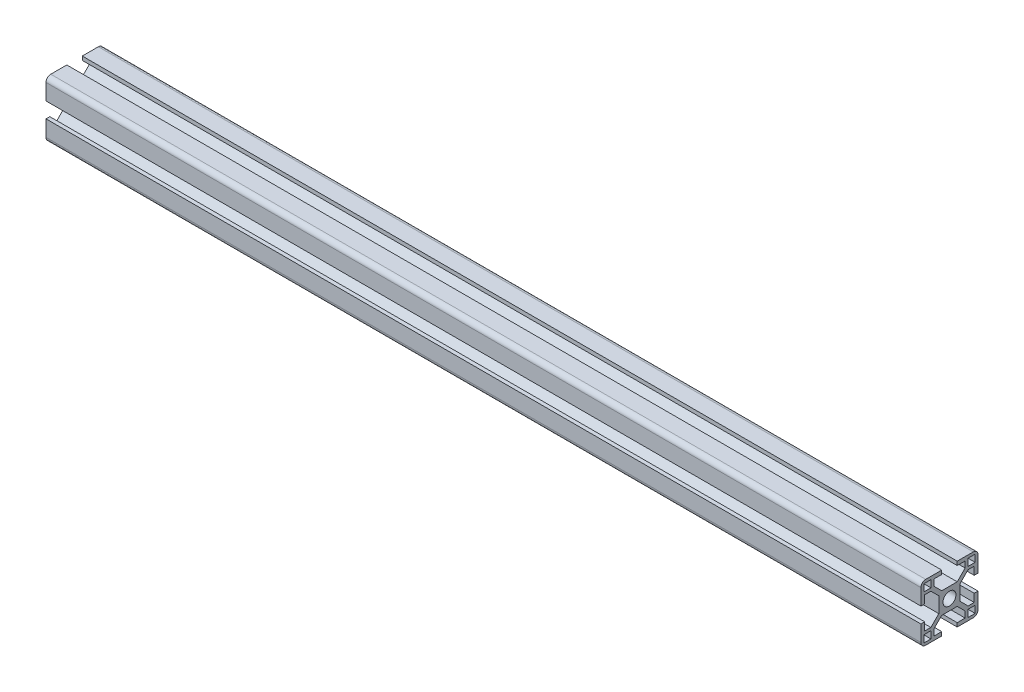
from build123d import *

# Parameters (mm, degrees)
SKETCH17_R                     = 3.4
SKETCH17_W                     = 3.75
SKETCH17_H                     = 3.75
T_SLOT_PROFILES_3030_2_1_DEPTH = 460


with BuildPart() as part:
    # Sketch17 → T-slot profiles 3030_2(1) (new body)
    with BuildSketch(Plane(origin=(0, 0, 0), x_dir=(0, 0, -1), z_dir=(1, 0, 0))):
        with BuildLine():
            Line((-4.07, 5.6), (4.07, 5.6))
            Line((4.07, 5.6), (8.25, 9.78))
            Line((8.25, 9.78), (8.25, 13))
            Line((8.25, 13), (4.07, 13))
            Line((4.07, 13), (4.07, 15))
            Line((4.07, 15), (12.5, 15))
            ThreePointArc((12.5, 15), (14.267766953, 14.267766953), (15, 12.5))
            Line((15, 12.5), (15, 4.07))
            Line((15, 4.07), (13, 4.07))
            Line((13, 4.07), (13, 8.25))
            Line((13, 8.25), (9.78, 8.25))
            Line((9.78, 8.25), (5.6, 4.07))
            Line((5.6, 4.07), (5.6, -4.07))
            Line((5.6, -4.07), (9.78, -8.25))
            Line((9.78, -8.25), (13, -8.25))
            Line((13, -8.25), (13, -4.07))
            Line((13, -4.07), (15, -4.07))
            Line((15, -4.07), (15, -12.5))
            ThreePointArc((15, -12.5), (14.267766953, -14.267766953), (12.5, -15))
            Line((12.5, -15), (4.07, -15))
            Line((4.07, -15), (4.07, -13))
            Line((4.07, -13), (8.25, -13))
            Line((8.25, -13), (8.25, -9.78))
            Line((8.25, -9.78), (4.07, -5.6))
            Line((4.07, -5.6), (-4.07, -5.6))
            Line((-4.07, -5.6), (-8.25, -9.78))
            Line((-8.25, -9.78), (-8.25, -13))
            Line((-8.25, -13), (-4.07, -13))
            Line((-4.07, -13), (-4.07, -15))
            Line((-4.07, -15), (-12.5, -15))
            ThreePointArc((-12.5, -15), (-14.267766953, -14.267766953), (-15, -12.5))
            Line((-15, -12.5), (-15, -4.07))
            Line((-15, -4.07), (-13, -4.07))
            Line((-13, -4.07), (-13, -8.25))
            Line((-13, -8.25), (-9.78, -8.25))
            Line((-9.78, -8.25), (-5.6, -4.07))
            Line((-5.6, -4.07), (-5.6, 4.07))
            Line((-5.6, 4.07), (-9.78, 8.25))
            Line((-9.78, 8.25), (-13, 8.25))
            Line((-13, 8.25), (-13, 4.07))
            Line((-13, 4.07), (-15, 4.07))
            Line((-15, 4.07), (-15, 12.5))
            ThreePointArc((-15, 12.5), (-14.267766953, 14.267766953), (-12.5, 15))
            Line((-12.5, 15), (-4.07, 15))
            Line((-4.07, 15), (-4.07, 13))
            Line((-4.07, 13), (-8.25, 13))
            Line((-8.25, 13), (-8.25, 9.78))
            Line((-8.25, 9.78), (-4.07, 5.6))
        make_face()
        Circle(SKETCH17_R, mode=Mode.SUBTRACT)
        with Locations((11.625, 11.625)):
            Rectangle(SKETCH17_W, SKETCH17_H, mode=Mode.SUBTRACT)
        with Locations((11.625, -11.625)):
            Rectangle(SKETCH17_W, SKETCH17_H, mode=Mode.SUBTRACT)
        with Locations((-11.625, 11.625)):
            Rectangle(SKETCH17_W, SKETCH17_H, mode=Mode.SUBTRACT)
        with Locations((-11.625, -11.625)):
            Rectangle(SKETCH17_W, SKETCH17_H, mode=Mode.SUBTRACT)
    extrude(amount=T_SLOT_PROFILES_3030_2_1_DEPTH)


solid = part.part
